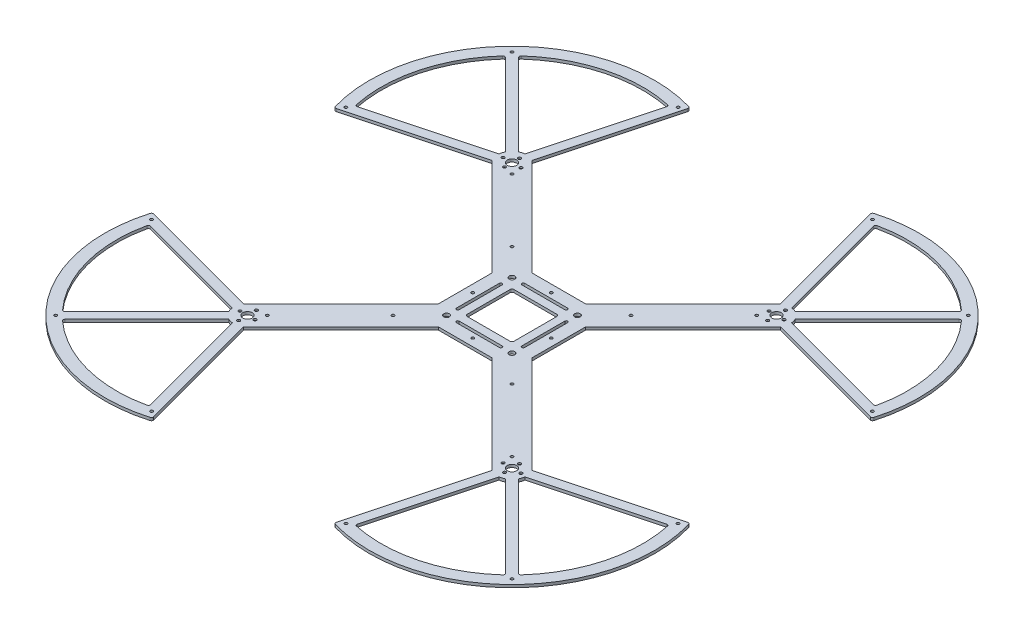
from build123d import *

# Parameters (mm, degrees)
SKETCH_1_R                = 5
SKETCH_1_R_2              = 3
SKETCH_1_R_3              = 1.5
EXTRUDE_1_DEPTH           = 3
HOLE_WIZARD_1_D           = 3.2
HOLE_WIZARD_1_CSINK_D     = 5.7
HOLE_WIZARD_1_CSINK_ANGLE = 90


with BuildPart() as part:
    # 草图1 → 凸台-拉伸1 (new body)
    with BuildSketch(Plane(origin=(0, 0, 0), x_dir=(1, 0, 0), z_dir=(0, 1, 0))):
        with BuildLine():
            Line((50, 28.786796564), (154.069199407, 132.855995972))
            Line((154.069199407, 132.855995972), (285.470213496, 97.647200362))
            ThreePointArc((285.470213496, 97.647200362), (286.970538089, 97.837119973), (287.909001026, 99.023008105))
            ThreePointArc((287.909001026, 99.023008105), (249.255140368, 249.255140368), (99.023008105, 287.909001026))
            ThreePointArc((99.023008105, 287.909001026), (97.837119973, 286.970538089), (97.647200362, 285.470213496))
            Line((97.647200362, 285.470213496), (132.855995972, 154.069199407))
            Line((132.855995972, 154.069199407), (28.786796564, 50))
            Line((28.786796564, 50), (-28.786796564, 50))
            Line((-28.786796564, 50), (-132.855995972, 154.069199407))
            Line((-132.855995972, 154.069199407), (-97.647200362, 285.470213496))
            ThreePointArc((-97.647200362, 285.470213496), (-97.837119973, 286.970538089), (-99.023008105, 287.909001026))
            ThreePointArc((-99.023008105, 287.909001026), (-249.255140368, 249.255140368), (-287.909001026, 99.023008105))
            ThreePointArc((-287.909001026, 99.023008105), (-286.970538089, 97.837119973), (-285.470213496, 97.647200362))
            Line((-285.470213496, 97.647200362), (-154.069199407, 132.855995972))
            Line((-154.069199407, 132.855995972), (-50, 28.786796564))
            Line((-50, 28.786796564), (-50, -28.786796564))
            Line((-50, -28.786796564), (-154.069199407, -132.855995972))
            Line((-154.069199407, -132.855995972), (-285.470213496, -97.647200362))
            ThreePointArc((-285.470213496, -97.647200362), (-286.970538089, -97.837119973), (-287.909001026, -99.023008105))
            ThreePointArc((-287.909001026, -99.023008105), (-249.255140368, -249.255140368), (-99.023008105, -287.909001026))
            ThreePointArc((-99.023008105, -287.909001026), (-97.837119973, -286.970538089), (-97.647200362, -285.470213496))
            Line((-97.647200362, -285.470213496), (-132.855995972, -154.069199407))
            Line((-132.855995972, -154.069199407), (-28.786796564, -50))
            Line((-28.786796564, -50), (28.786796564, -50))
            Line((28.786796564, -50), (132.855995972, -154.069199407))
            Line((132.855995972, -154.069199407), (97.647200362, -285.470213496))
            ThreePointArc((97.647200362, -285.470213496), (97.837119973, -286.970538089), (99.023008105, -287.909001026))
            ThreePointArc((99.023008105, -287.909001026), (249.255140368, -249.255140368), (287.909001026, -99.023008105))
            ThreePointArc((287.909001026, -99.023008105), (286.970538089, -97.837119973), (285.470213496, -97.647200362))
            Line((285.470213496, -97.647200362), (154.069199407, -132.855995972))
            Line((154.069199407, -132.855995972), (50, -28.786796564))
            Line((50, -28.786796564), (50, 28.786796564))
        make_face()
        with Locations(Location((141.421356237, 141.421356237, 0), (0, 0, 270))):
            Circle(SKETCH_1_R, mode=Mode.SUBTRACT)
        with Locations(Location((-141.421356237, 141.421356237, 0), (0, 0, 90))):
            Circle(SKETCH_1_R, mode=Mode.SUBTRACT)
        with Locations(Location((141.421356237, -141.421356237, 0), (0, 0, 90))):
            Circle(SKETCH_1_R, mode=Mode.SUBTRACT)
        with Locations(Location((-141.421356237, -141.421356237, 0), (0, 0, 270))):
            Circle(SKETCH_1_R, mode=Mode.SUBTRACT)
        with Locations(Location((35, 35, 0), (0, 0, 270))):
            Circle(SKETCH_1_R_2, mode=Mode.SUBTRACT)
        with Locations(Location((35, -35, 0), (0, 0, 270))):
            Circle(SKETCH_1_R_2, mode=Mode.SUBTRACT)
        with Locations(Location((-35, -35, 0), (0, 0, 270))):
            Circle(SKETCH_1_R_2, mode=Mode.SUBTRACT)
        with Locations(Location((-35, 35, 0), (0, 0, 270))):
            Circle(SKETCH_1_R_2, mode=Mode.SUBTRACT)
        with Locations(Location((243.951839509, 243.951839509, 0), (0, 0, 270))):
            Circle(SKETCH_1_R_3, mode=Mode.SUBTRACT)
        with Locations(Location((103.892594697, 281.480601049, 0), (0, 0, 90))):
            Circle(SKETCH_1_R_3, mode=Mode.SUBTRACT)
        with Locations(Location((281.480601049, 103.892594697, 0), (0, 0, 90))):
            Circle(SKETCH_1_R_3, mode=Mode.SUBTRACT)
        with Locations(Location((-103.892594697, 281.480601049, 0), (0, 0, 270))):
            Circle(SKETCH_1_R_3, mode=Mode.SUBTRACT)
        with Locations(Location((-281.480601049, 103.892594697, 0), (0, 0, 270))):
            Circle(SKETCH_1_R_3, mode=Mode.SUBTRACT)
        with Locations(Location((-243.951839509, 243.951839509, 0), (0, 0, 90))):
            Circle(SKETCH_1_R_3, mode=Mode.SUBTRACT)
        with Locations(Location((281.480601049, -103.892594697, 0), (0, 0, 270))):
            Circle(SKETCH_1_R_3, mode=Mode.SUBTRACT)
        with Locations(Location((243.951839509, -243.951839509, 0), (0, 0, 90))):
            Circle(SKETCH_1_R_3, mode=Mode.SUBTRACT)
        with Locations(Location((103.892594697, -281.480601049, 0), (0, 0, 270))):
            Circle(SKETCH_1_R_3, mode=Mode.SUBTRACT)
        with Locations(Location((-103.892594697, -281.480601049, 0), (0, 0, 90))):
            Circle(SKETCH_1_R_3, mode=Mode.SUBTRACT)
        with Locations(Location((-243.951839509, -243.951839509, 0), (0, 0, 270))):
            Circle(SKETCH_1_R_3, mode=Mode.SUBTRACT)
        with Locations(Location((-281.480601049, -103.892594697, 0), (0, 0, 90))):
            Circle(SKETCH_1_R_3, mode=Mode.SUBTRACT)
        with Locations(Location((42, 0, 0), (0, 0, 270))):
            Circle(SKETCH_1_R_3, mode=Mode.SUBTRACT)
        with Locations(Location((-42, 0, 0), (0, 0, 90))):
            Circle(SKETCH_1_R_3, mode=Mode.SUBTRACT)
        with Locations(Location((0, 42, 0), (0, 0, 90))):
            Circle(SKETCH_1_R_3, mode=Mode.SUBTRACT)
        with Locations(Location((0, -42, 0), (0, 0, 270))):
            Circle(SKETCH_1_R_3, mode=Mode.SUBTRACT)
        with Locations(Location((130.81475452, 130.81475452, 0), (0, 0, 270))):
            Circle(SKETCH_1_R_3, mode=Mode.SUBTRACT)
        with Locations(Location((63.639610307, 63.639610307, 0), (0, 0, 270))):
            Circle(SKETCH_1_R_3, mode=Mode.SUBTRACT)
        with Locations(Location((-63.639610307, 63.639610307, 0), (0, 0, 90))):
            Circle(SKETCH_1_R_3, mode=Mode.SUBTRACT)
        with Locations(Location((-130.81475452, 130.81475452, 0), (0, 0, 90))):
            Circle(SKETCH_1_R_3, mode=Mode.SUBTRACT)
        with Locations(Location((63.639610307, -63.639610307, 0), (0, 0, 90))):
            Circle(SKETCH_1_R_3, mode=Mode.SUBTRACT)
        with Locations(Location((130.81475452, -130.81475452, 0), (0, 0, 90))):
            Circle(SKETCH_1_R_3, mode=Mode.SUBTRACT)
        with Locations(Location((-130.81475452, -130.81475452, 0), (0, 0, 270))):
            Circle(SKETCH_1_R_3, mode=Mode.SUBTRACT)
        with Locations(Location((-63.639610307, -63.639610307, 0), (0, 0, 270))):
            Circle(SKETCH_1_R_3, mode=Mode.SUBTRACT)
        with BuildLine():
            Line((235.340940206, 242.412008018), (147.885822331, 154.956890143))
            ThreePointArc((147.885822331, 154.956890143), (145.303641914, 155.910243632), (142.590731331, 156.375705501))
            Line((142.590731331, 156.375705501), (110.579936498, 275.841618209))
            ThreePointArc((110.579936498, 275.841618209), (110.805665345, 277.402877386), (112.092808903, 278.314878039))
            ThreePointArc((112.092808903, 278.314878039), (177.656022552, 276.650971918), (235.267384186, 245.310350064))
            ThreePointArc((235.267384186, 245.310350064), (235.926082879, 243.876962551), (235.340940206, 242.412008018))
        make_face(mode=Mode.SUBTRACT)
        with BuildLine():
            Line((242.412008018, 235.340940206), (154.956890143, 147.885822331))
            ThreePointArc((154.956890143, 147.885822331), (155.910243632, 145.303641914), (156.375705501, 142.590731331))
            Line((156.375705501, 142.590731331), (275.841618209, 110.579936498))
            ThreePointArc((275.841618209, 110.579936498), (277.402877386, 110.805665345), (278.314878039, 112.092808903))
            ThreePointArc((278.314878039, 112.092808903), (276.650971918, 177.656022552), (245.310350064, 235.267384186))
            ThreePointArc((245.310350064, 235.267384186), (243.876962551, 235.926082879), (242.412008018, 235.340940206))
        make_face(mode=Mode.SUBTRACT)
        with BuildLine():
            Line((-275.841618209, 110.579936498), (-156.375705501, 142.590731331))
            ThreePointArc((-156.375705501, 142.590731331), (-155.910243632, 145.303641914), (-154.956890143, 147.885822331))
            Line((-154.956890143, 147.885822331), (-242.412008018, 235.340940206))
            ThreePointArc((-242.412008018, 235.340940206), (-243.876962551, 235.926082879), (-245.310350064, 235.267384186))
            ThreePointArc((-245.310350064, 235.267384186), (-276.650971918, 177.656022552), (-278.314878039, 112.092808903))
            ThreePointArc((-278.314878039, 112.092808903), (-277.402877386, 110.805665345), (-275.841618209, 110.579936498))
        make_face(mode=Mode.SUBTRACT)
        with BuildLine():
            Line((-235.340940206, 242.412008018), (-147.885822331, 154.956890143))
            ThreePointArc((-147.885822331, 154.956890143), (-145.303641914, 155.910243632), (-142.590731331, 156.375705501))
            Line((-142.590731331, 156.375705501), (-110.579936498, 275.841618209))
            ThreePointArc((-110.579936498, 275.841618209), (-110.805665345, 277.402877386), (-112.092808903, 278.314878039))
            ThreePointArc((-112.092808903, 278.314878039), (-177.656022552, 276.650971918), (-235.267384186, 245.310350064))
            ThreePointArc((-235.267384186, 245.310350064), (-235.926082879, 243.876962551), (-235.340940206, 242.412008018))
        make_face(mode=Mode.SUBTRACT)
        with BuildLine():
            Line((-235.340940206, -242.412008018), (-147.885822331, -154.956890143))
            ThreePointArc((-147.885822331, -154.956890143), (-145.303641914, -155.910243632), (-142.590731331, -156.375705501))
            Line((-142.590731331, -156.375705501), (-110.579936498, -275.841618209))
            ThreePointArc((-110.579936498, -275.841618209), (-110.805665345, -277.402877386), (-112.092808903, -278.314878039))
            ThreePointArc((-112.092808903, -278.314878039), (-177.656022552, -276.650971918), (-235.267384186, -245.310350064))
            ThreePointArc((-235.267384186, -245.310350064), (-235.926082879, -243.876962551), (-235.340940206, -242.412008018))
        make_face(mode=Mode.SUBTRACT)
        with BuildLine():
            Line((-242.412008018, -235.340940206), (-154.956890143, -147.885822331))
            ThreePointArc((-154.956890143, -147.885822331), (-155.910243632, -145.303641914), (-156.375705501, -142.590731331))
            Line((-156.375705501, -142.590731331), (-275.841618209, -110.579936498))
            ThreePointArc((-275.841618209, -110.579936498), (-277.402877386, -110.805665345), (-278.314878039, -112.092808903))
            ThreePointArc((-278.314878039, -112.092808903), (-276.650971918, -177.656022552), (-245.310350064, -235.267384186))
            ThreePointArc((-245.310350064, -235.267384186), (-243.876962551, -235.926082879), (-242.412008018, -235.340940206))
        make_face(mode=Mode.SUBTRACT)
        with BuildLine():
            Line((275.841618209, -110.579936498), (156.375705501, -142.590731331))
            ThreePointArc((156.375705501, -142.590731331), (155.910243632, -145.303641914), (154.956890143, -147.885822331))
            Line((154.956890143, -147.885822331), (242.412008018, -235.340940206))
            ThreePointArc((242.412008018, -235.340940206), (243.876962551, -235.926082879), (245.310350064, -235.267384186))
            ThreePointArc((245.310350064, -235.267384186), (276.650971918, -177.656022552), (278.314878039, -112.092808903))
            ThreePointArc((278.314878039, -112.092808903), (277.402877386, -110.805665345), (275.841618209, -110.579936498))
        make_face(mode=Mode.SUBTRACT)
        with BuildLine():
            Line((235.340940206, -242.412008018), (147.885822331, -154.956890143))
            ThreePointArc((147.885822331, -154.956890143), (145.303641914, -155.910243632), (142.590731331, -156.375705501))
            Line((142.590731331, -156.375705501), (110.579936498, -275.841618209))
            ThreePointArc((110.579936498, -275.841618209), (110.805665345, -277.402877386), (112.092808903, -278.314878039))
            ThreePointArc((112.092808903, -278.314878039), (177.656022552, -276.650971918), (235.267384186, -245.310350064))
            ThreePointArc((235.267384186, -245.310350064), (235.926082879, -243.876962551), (235.340940206, -242.412008018))
        make_face(mode=Mode.SUBTRACT)
        with BuildLine():
            Line((-23, -25), (23, -25))
            ThreePointArc((23, -25), (24.414213562, -24.414213562), (25, -23))
            Line((25, -23), (25, 23))
            ThreePointArc((25, 23), (24.414213562, 24.414213562), (23, 25))
            Line((23, 25), (-23, 25))
            ThreePointArc((-23, 25), (-24.414213562, 24.414213562), (-25, 23))
            Line((-25, 23), (-25, -23))
            ThreePointArc((-25, -23), (-24.414213562, -24.414213562), (-23, -25))
        make_face(mode=Mode.SUBTRACT)
        with BuildLine():
            Line((33.5, 23), (33.5, -23))
            ThreePointArc((33.5, -23), (35, -24.5), (36.5, -23))
            Line((36.5, -23), (36.5, 23))
            ThreePointArc((36.5, 23), (35, 24.5), (33.5, 23))
        make_face(mode=Mode.SUBTRACT)
        with BuildLine():
            Line((-36.5, -23), (-36.5, 23))
            ThreePointArc((-36.5, 23), (-35, 24.5), (-33.5, 23))
            Line((-33.5, 23), (-33.5, -23))
            ThreePointArc((-33.5, -23), (-35, -24.5), (-36.5, -23))
        make_face(mode=Mode.SUBTRACT)
        with BuildLine():
            Line((23, 36.5), (-23, 36.5))
            ThreePointArc((-23, 36.5), (-24.5, 35), (-23, 33.5))
            Line((-23, 33.5), (23, 33.5))
            ThreePointArc((23, 33.5), (24.5, 35), (23, 36.5))
        make_face(mode=Mode.SUBTRACT)
        with BuildLine():
            Line((-23, -33.5), (23, -33.5))
            ThreePointArc((23, -33.5), (24.5, -35), (23, -36.5))
            Line((23, -36.5), (-23, -36.5))
            ThreePointArc((-23, -36.5), (-24.5, -35), (-23, -33.5))
        make_face(mode=Mode.SUBTRACT)
    extrude(amount=EXTRUDE_1_DEPTH)

    # 大小十字凹头螺钉锥孔1 (through all)
    with Locations(Plane(origin=(141.421356237, 0, -131.921356237), x_dir=(0, 0, -1), z_dir=(0, -1, 0))):
        with Locations((0, 0), (9.5, 8), (19, 0), (9.5, -8), (-273.342712474, -9.5), (-273.342712474, 9.5), (-265.342712474, 0), (-281.342712474, 0), (-263.842712474, -282.842712474), (-282.842712474, -282.842712474), (-273.342712474, -274.842712474), (-273.342712474, -290.842712474), (9.5, -273.342712474), (9.5, -292.342712474), (17.5, -282.842712474), (1.5, -282.842712474)):
            CounterSinkHole(HOLE_WIZARD_1_D / 2, HOLE_WIZARD_1_CSINK_D / 2, counter_sink_angle=HOLE_WIZARD_1_CSINK_ANGLE)


solid = part.part
